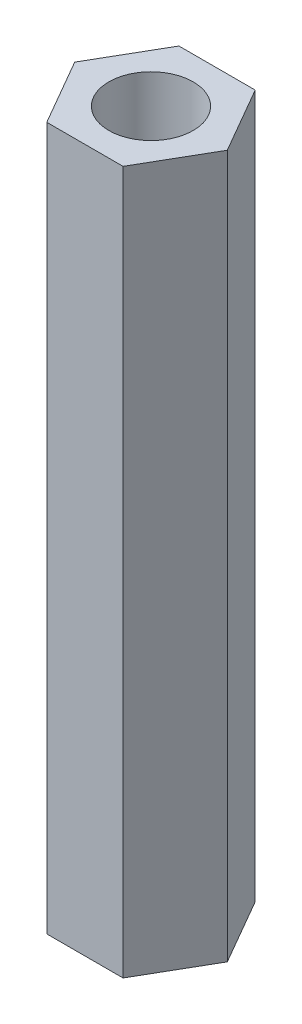
from build123d import *

# Parameters (mm, degrees)
SKETCH_1_R      = 1.5
EXTRUDE_1_DEPTH = 25


with BuildPart() as part:
    # 草图1 → 凸台-拉伸1 (new body)
    with BuildSketch(Plane(origin=(0, 0, 0), x_dir=(1, 0, 0), z_dir=(0, 1, 0))):
        Polygon((2.713546265, 0), (1.356773133, 2.35), (-1.356773133, 2.35), (-2.713546265, 0), (-1.356773133, -2.35), (1.356773133, -2.35), align=None)
        with Locations(Location((0, 0, 0), (0, 0, 270))):
            Circle(SKETCH_1_R, mode=Mode.SUBTRACT)
    extrude(amount=EXTRUDE_1_DEPTH)


solid = part.part
